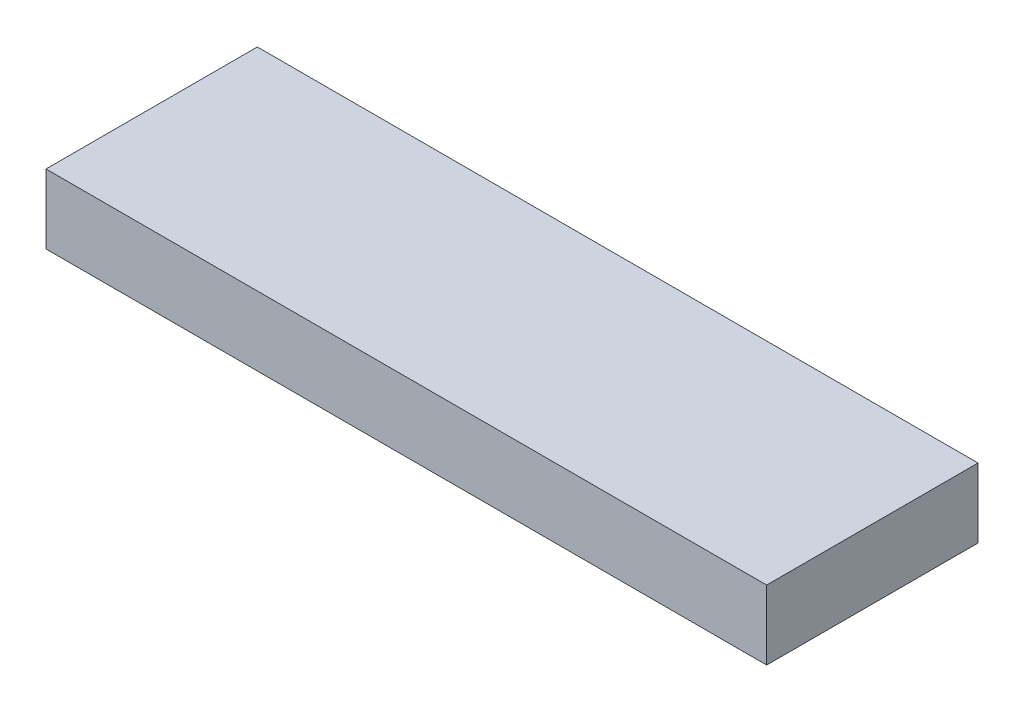
from build123d import *

# Parameters (mm, degrees)
SKETCH_1_W      = 208
SKETCH_1_H      = 61
EXTRUDE_1_DEPTH = 20


with BuildPart() as part:
    # ｽｹｯﾁ1 → ﾎﾞｽ - 押し出し1 (new body)
    with BuildSketch(Plane(origin=(0, 0, 0), x_dir=(1, 0, 0), z_dir=(0, 1, 0))):
        Rectangle(SKETCH_1_W, SKETCH_1_H)
    extrude(amount=EXTRUDE_1_DEPTH)


solid = part.part
